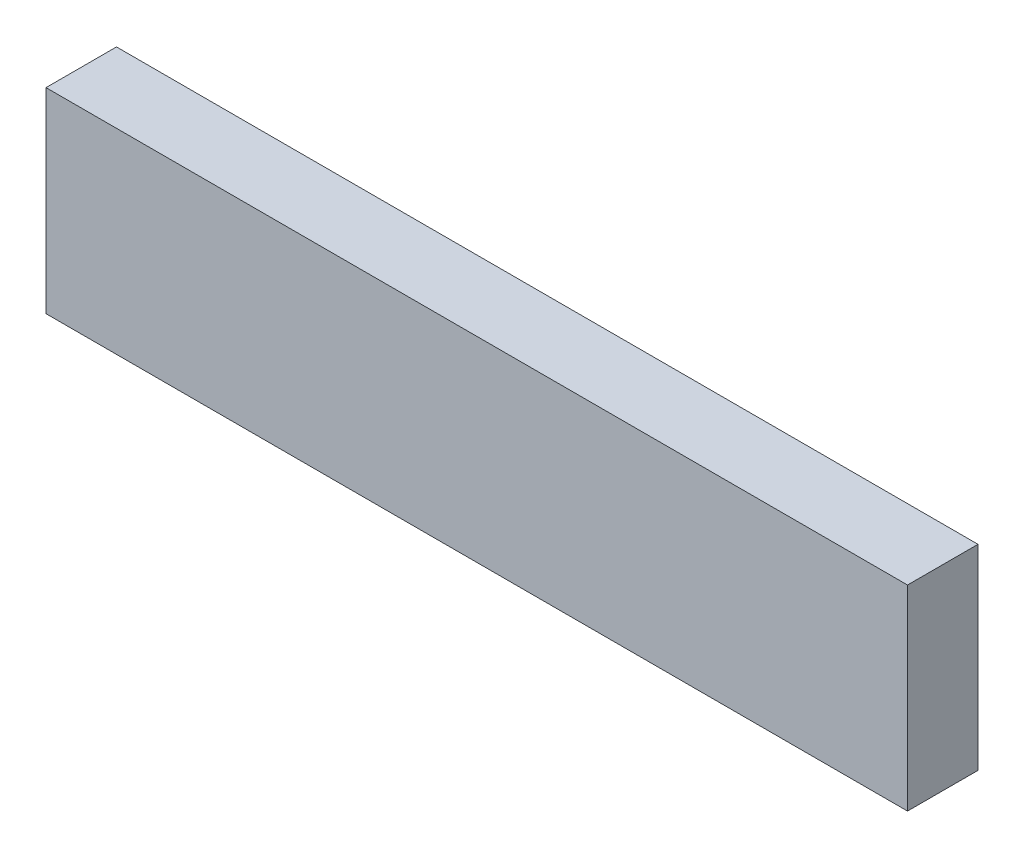
from build123d import *

# Parameters (mm, degrees)
SKETCH1_W           = 220
SKETCH1_H           = 50
BOSS_EXTRUDE1_DEPTH = 18


with BuildPart() as part:
    # Sketch1 → Boss-Extrude1 (new body)
    with BuildSketch(Plane.XY):
        Rectangle(SKETCH1_W, SKETCH1_H)
    extrude(amount=BOSS_EXTRUDE1_DEPTH)


solid = part.part
